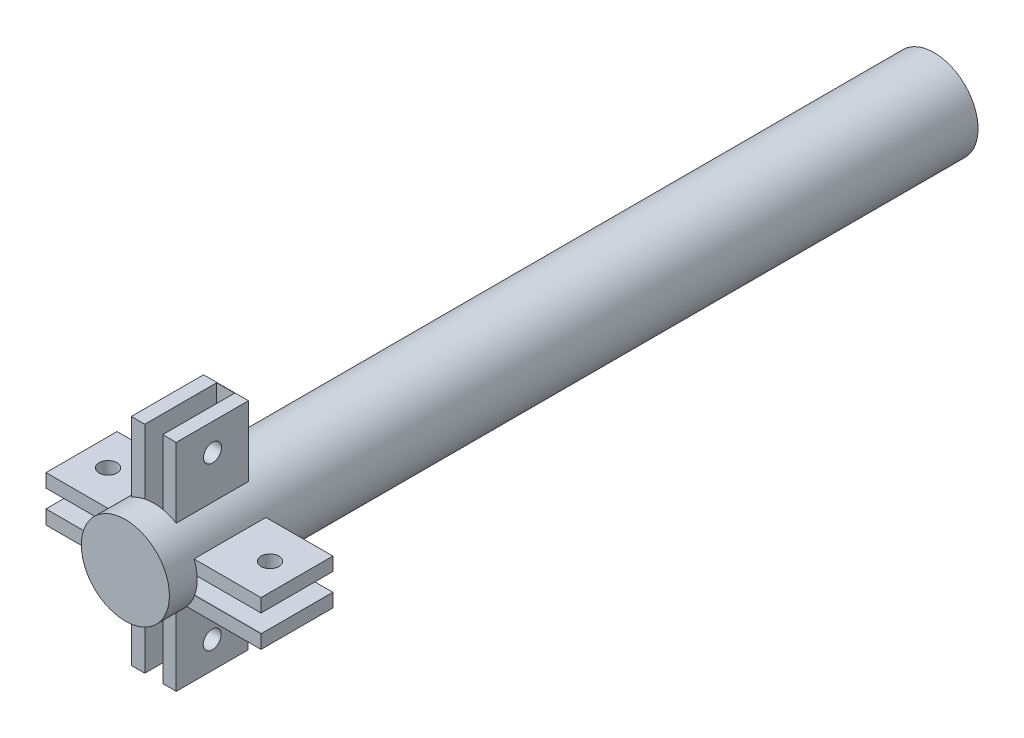
from build123d import *

# Parameters (mm, degrees)
SKETCH_1_R           = 49
EXTRUDE_1_DEPTH      = 800
SKETCH_6_W           = 80
SKETCH_6_H           = 50
EXTRUDE_4_DEPTH      = 120
SKETCH_7_W           = 79.068992587
SKETCH_7_H           = 50.572115984
EXTRUDE_5_DEPTH      = 120
SKETCH_8_W           = 50
SKETCH_8_H           = 80
EXTRUDE_6_DEPTH      = 120
SKETCH_11_W          = 50
SKETCH_11_H          = 80
EXTRUDE_7_DEPTH      = 240
SKETCH_12_W          = 81
SKETCH_12_H          = 20
CUT_EXTRUDE_2_DEPTH  = 240
SKETCH_13_W          = 0.776791224
SKETCH_13_H          = 19.974152477
CUT_EXTRUDE_3_DEPTH  = 240
SKETCH_14_W          = 20
SKETCH_14_H          = 80
CUT_EXTRUDE_4_DEPTH  = 240
SKETCH_15_R          = 10
CUT_EXTRUDE_5_DEPTH  = 240
SKETCH_16_R          = 10
CUT_EXTRUDE_7_DEPTH  = 240
SKETCH_17_R          = 10
CUT_EXTRUDE_8_DEPTH  = 240
SKETCH_18_R          = 10
CUT_EXTRUDE_9_DEPTH  = 240
SKETCH_20_R          = 49
EXTRUDE_11_DEPTH     = 600
SKETCH_19_R          = 37.31025629
CUT_EXTRUDE_10_DEPTH = 818.80193201
CUT_EXTRUDE_START    = -600
SKETCH_21_R          = 49
CUT_EXTRUDE_11_DEPTH = 600
EXTRUDE_START        = 600
SKETCH_22_R          = 49
EXTRUDE_12_DEPTH     = 600
SKETCH_23_R          = 49
CUT_EXTRUDE_13_DEPTH = 500


with BuildPart() as part:
    # 草图1 → 凸台-拉伸1 (new body)
    with BuildSketch(Plane.XY):
        Circle(SKETCH_1_R)
    extrude(amount=EXTRUDE_1_DEPTH)

    # 草图6 → 凸台-拉伸4 (add)
    with BuildSketch(Plane(origin=(0, 0, 0), x_dir=(0, 0, -1), z_dir=(1, 0, 0))):
        with Locations((-729.062639013, -6.734256512)):
            Rectangle(SKETCH_6_W, SKETCH_6_H)
    extrude(amount=EXTRUDE_4_DEPTH)

    # 草图7 → 凸台-拉伸5 (add)
    with BuildSketch(Plane(origin=(0, 0, 0), x_dir=(0, 0, -1), z_dir=(1, 0, 0))):
        with Locations((-728.814319263, -6.902168752)):
            Rectangle(SKETCH_7_W, SKETCH_7_H)
    extrude(amount=-EXTRUDE_5_DEPTH)

    # 草图8 → 凸台-拉伸6 (add)
    with BuildSketch(Plane(origin=(0, 0, 0), x_dir=(1, 0, 0), z_dir=(0, 1, 0))):
        with Locations((0, -728.037522505)):
            Rectangle(SKETCH_8_W, SKETCH_8_H)
    extrude(amount=EXTRUDE_6_DEPTH)

    # 草图11 → 凸台-拉伸7 (add)
    with BuildSketch(Plane(origin=(0, 120, 0), x_dir=(1, 0, 0), z_dir=(0, 1, 0))):
        with Locations((0, -728.408363968)):
            Rectangle(SKETCH_11_W, SKETCH_11_H)
    extrude(amount=-EXTRUDE_7_DEPTH)

    # 草图12 → 切除-拉伸2 (cut)
    with BuildSketch(Plane.ZY.offset(120)):
        with Locations((727.848815556, -6.61611076)):
            Rectangle(SKETCH_12_W, SKETCH_12_H)
    extrude(amount=-CUT_EXTRUDE_2_DEPTH, mode=Mode.SUBTRACT)

    # 草图13 → 切除-拉伸3 (cut)
    with BuildSketch(Plane(origin=(120, 0, 0), x_dir=(0, 0, -1), z_dir=(1, 0, 0))):
        with Locations((-768.737211168, -6.577297247)):
            Rectangle(SKETCH_13_W, SKETCH_13_H)
    extrude(amount=-CUT_EXTRUDE_3_DEPTH, mode=Mode.SUBTRACT)

    # 草图14 → 切除-拉伸4 (cut)
    with BuildSketch(Plane(origin=(0, -120, 0), x_dir=(-1, 0, 0), z_dir=(0, -1, 0))):
        with Locations((0, -728.408363968)):
            Rectangle(SKETCH_14_W, SKETCH_14_H)
    extrude(amount=-CUT_EXTRUDE_4_DEPTH, mode=Mode.SUBTRACT)

    # 草图15 → 切除-拉伸5 (cut)
    with BuildSketch(Plane(origin=(0, 18.38388924, 0), x_dir=(1, 0, 0), z_dir=(0, 1, 0))):
        with Locations(Location((-90, -729.279822969, 0), (0, 0, 270))):
            Circle(SKETCH_15_R)
    extrude(amount=-CUT_EXTRUDE_5_DEPTH, mode=Mode.SUBTRACT)

    # 草图16 → 切除-拉伸7 (cut)
    with BuildSketch(Plane.ZY.offset(25)):
        with Locations((728.037522505, 90)):
            Circle(SKETCH_16_R)
    extrude(amount=-CUT_EXTRUDE_7_DEPTH, mode=Mode.SUBTRACT)

    # 草图17 → 切除-拉伸8 (cut)
    with BuildSketch(Plane(origin=(0, 18.265743488, 0), x_dir=(1, 0, 0), z_dir=(0, 1, 0))):
        with Locations(Location((90, -729.062639013, 0), (0, 0, 270))):
            Circle(SKETCH_17_R)
    extrude(amount=-CUT_EXTRUDE_8_DEPTH, mode=Mode.SUBTRACT)

    # 草图18 → 切除-拉伸9 (cut)
    with BuildSketch(Plane(origin=(25, 0, 0), x_dir=(0, 0, -1), z_dir=(1, 0, 0))):
        with Locations((-728.408363968, -90)):
            Circle(SKETCH_18_R)
    extrude(amount=-CUT_EXTRUDE_9_DEPTH, mode=Mode.SUBTRACT)

    # 草图20 → 凸台-拉伸11 (add)
    with BuildSketch(Plane.XY.offset(800)):
        Circle(SKETCH_20_R)
    extrude(amount=EXTRUDE_11_DEPTH)

    # 草图19 → 切除-拉伸10 (cut, through all)
    with BuildSketch(Plane.XY.offset(800)):
        Circle(SKETCH_19_R)
    extrude(amount=CUT_EXTRUDE_10_DEPTH, mode=Mode.SUBTRACT)

    # 草图21 → 切除-拉伸11 (cut)
    with BuildSketch(Plane.XY.offset(1400).offset(CUT_EXTRUDE_START)):
        Circle(SKETCH_21_R)
    extrude(amount=CUT_EXTRUDE_11_DEPTH, mode=Mode.SUBTRACT)

    # 草图22 → 凸台-拉伸12 (add)
    with BuildSketch(Plane(origin=(0, 0, 0), x_dir=(-1, 0, 0), z_dir=(0, 0, -1)).offset(EXTRUDE_START)):
        Circle(SKETCH_22_R)
    extrude(amount=-EXTRUDE_12_DEPTH)

    # 草图23 → 切除-拉伸13 (cut)
    with BuildSketch(Plane(origin=(0, 0, -600), x_dir=(-1, 0, 0), z_dir=(0, 0, -1))):
        Circle(SKETCH_23_R)
    extrude(amount=-CUT_EXTRUDE_13_DEPTH, mode=Mode.SUBTRACT)


solid = part.part
